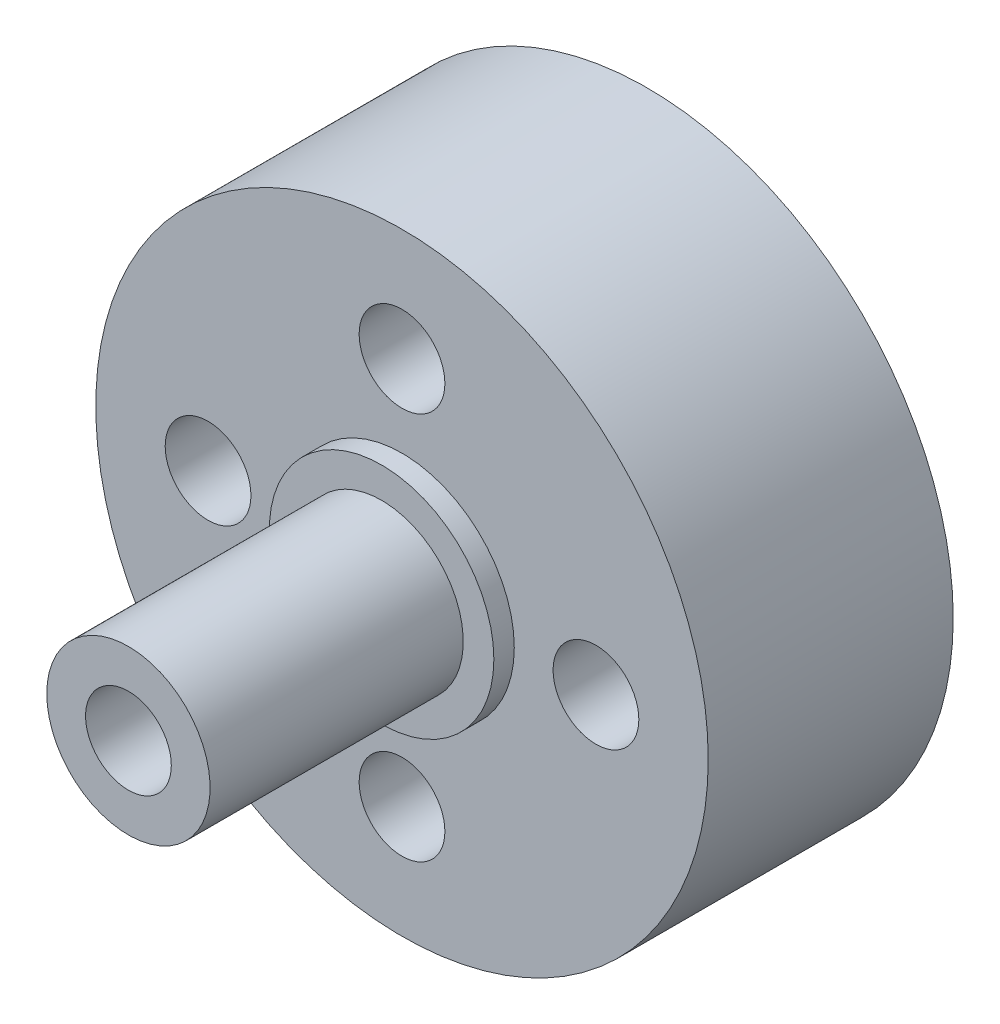
from build123d import *

# Parameters (mm, degrees)
SKETCH_1_R      = 15
EXTRUDE_1_DEPTH = 12
SKETCH_2_R      = 5.5
EXTRUDE_2_DEPTH = 1
SKETCH_3_R      = 4
EXTRUDE_3_DEPTH = 12.4
M5X0_81_D       = 4.2
M5X0_82_D       = 4.2
M5X0_82_DEPTH   = 14
M5X0_82_TIP     = 1.2618073


with BuildPart() as part:
    # Эскиз1 → Бобышка-Вытянуть1 (new body)
    with BuildSketch(Plane.XY):
        Circle(SKETCH_1_R)
    extrude(amount=EXTRUDE_1_DEPTH)

    # Эскиз2 → Бобышка-Вытянуть2 (add)
    with BuildSketch(Plane.XY.offset(12)):
        Circle(SKETCH_2_R)
    extrude(amount=EXTRUDE_2_DEPTH)

    # Эскиз3 → Бобышка-Вытянуть3 (add)
    with BuildSketch(Plane.XY.offset(13)):
        with Locations(Location((0, 0, 0), (0, 0, 180))):
            Circle(SKETCH_3_R)
    extrude(amount=EXTRUDE_3_DEPTH)

    # Отверстие обработанное метчиком M5x0.81 (through all)
    with Locations(Plane(origin=(0, 0, 0), x_dir=(-1, 0, 0), z_dir=(0, 0, -1))):
        with Locations((0, 9.5), (9.5, 0), (-9.5, 0), (0, -9.5)):
            Hole(M5X0_81_D / 2)

    # Отверстие обработанное метчиком M5x0.82
    with Locations(Plane.XY.offset(25.4)):
        with Locations((0, 0)):
            Hole(M5X0_82_D / 2, depth=M5X0_82_DEPTH)
            with Locations((0, 0, -(M5X0_82_DEPTH + M5X0_82_TIP / 2))):  # 118° drill point
                Cone(0, M5X0_82_D / 2, M5X0_82_TIP, mode=Mode.SUBTRACT)


solid = part.part
